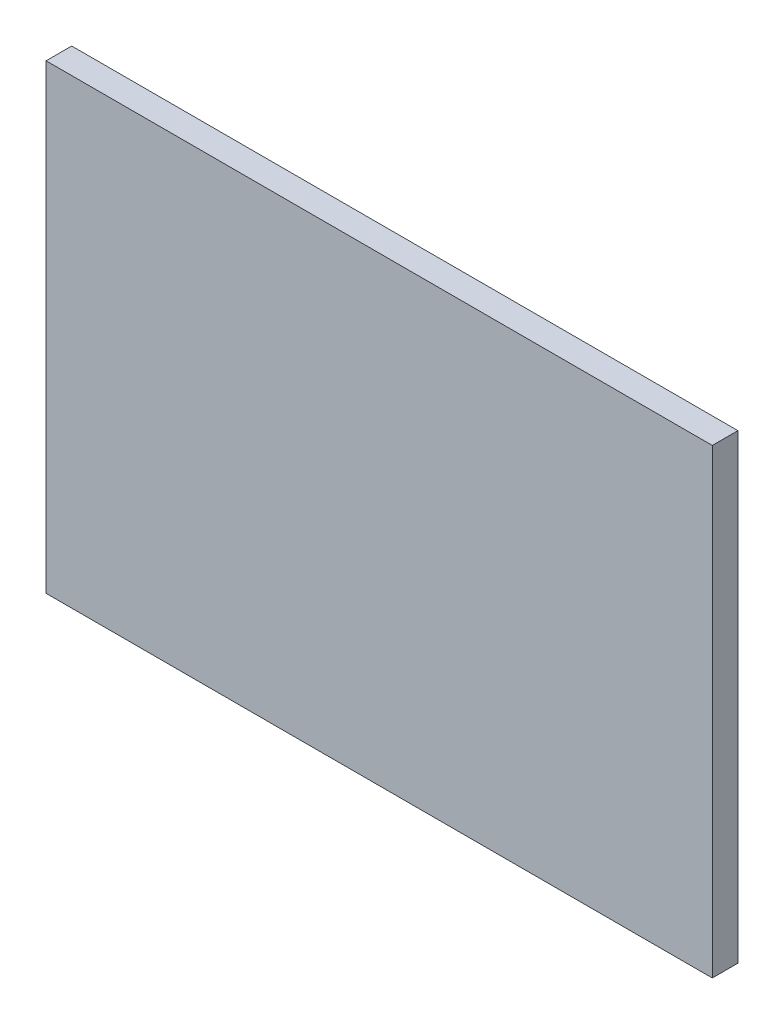
from build123d import *

# Parameters (mm, degrees)
SKETCH_1_W      = 26
SKETCH_1_H      = 18
EXTRUDE_1_DEPTH = 1


with BuildPart() as part:
    # Эскиз1 → Бобышка-Вытянуть1 (new body)
    with BuildSketch(Plane.XY):
        Rectangle(SKETCH_1_W, SKETCH_1_H)
    extrude(amount=-EXTRUDE_1_DEPTH)


solid = part.part
